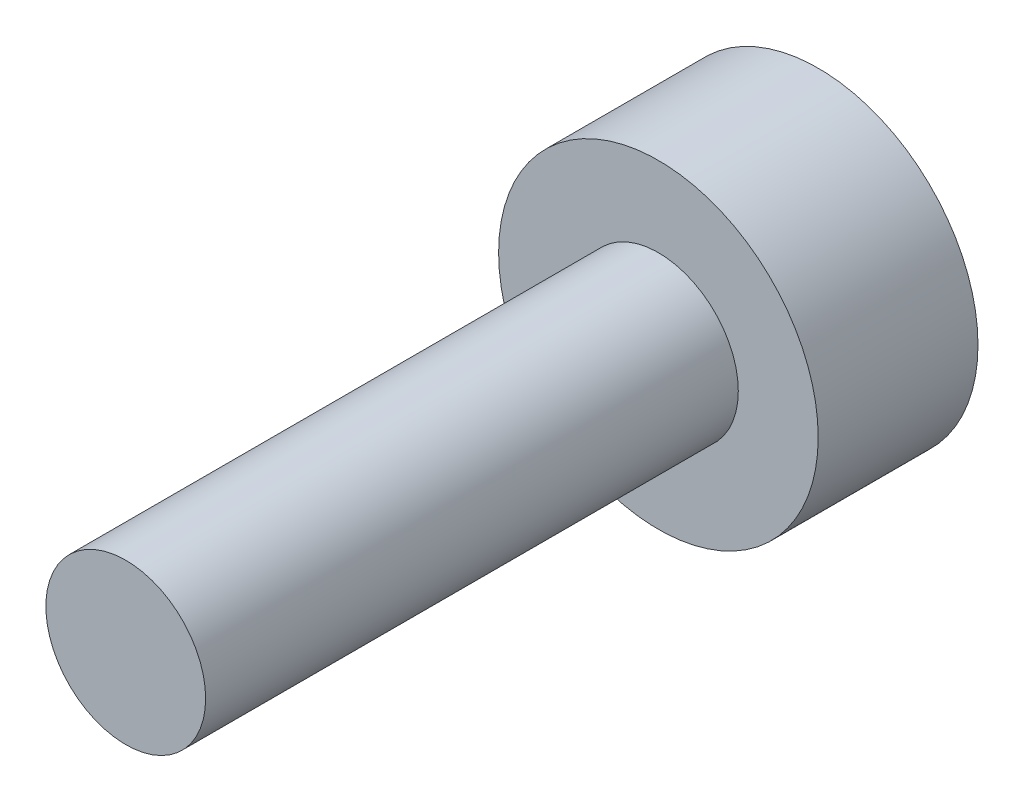
from build123d import *

# Parameters (mm, degrees)
SKETCH1_R           = 1.5
BOSS_EXTRUDE1_DEPTH = 10
SKETCH2_R           = 3
BOSS_EXTRUDE2_DEPTH = 3


with BuildPart() as part:
    # Sketch1 → Boss-Extrude1 (new body)
    with BuildSketch(Plane.XY):
        with Locations((-1.849508113, 0.425595617)):
            Circle(SKETCH1_R)
    extrude(amount=BOSS_EXTRUDE1_DEPTH)

    # Sketch2 → Boss-Extrude2 (add)
    with BuildSketch(Plane(origin=(0, 0, 0), x_dir=(-1, 0, 0), z_dir=(0, 0, -1))):
        with Locations((1.849508113, 0.425595617)):
            Circle(SKETCH2_R)
    extrude(amount=BOSS_EXTRUDE2_DEPTH)


solid = part.part
